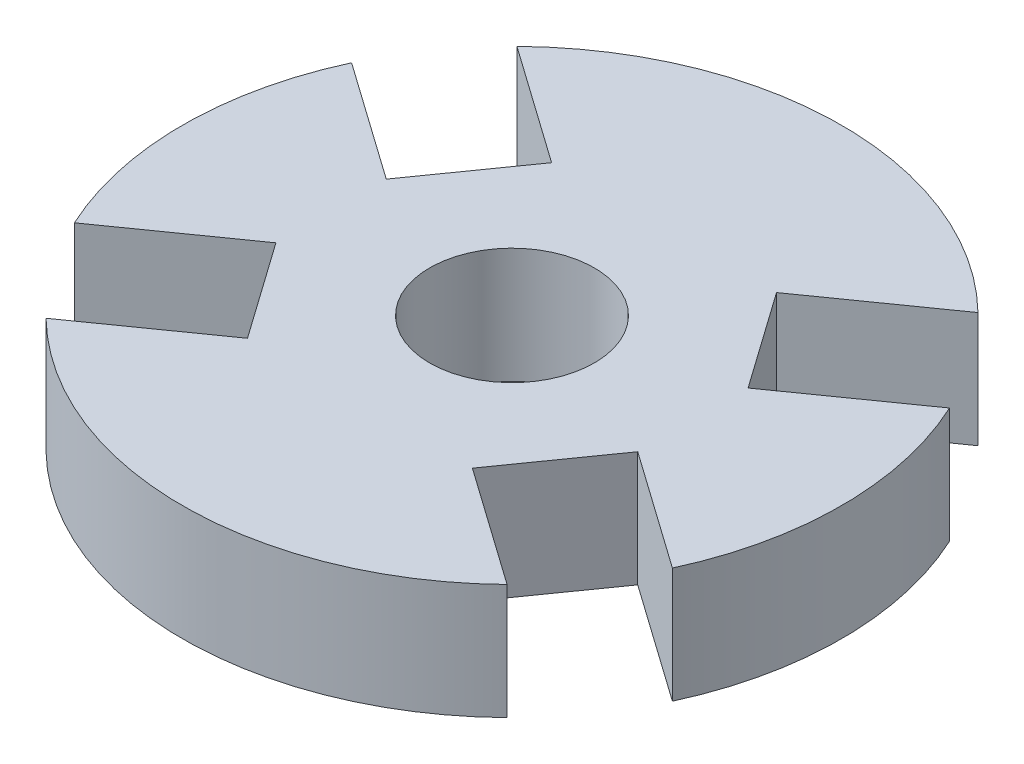
from build123d import *

# Parameters (mm, degrees)
CROQUIS1_R              = 10
CROQUIS1_R_2            = 2.5
SALIENTE_EXTRUIR1_DEPTH = 3.5
CORTAR_EXTRUIR1_DEPTH   = 3.5


with BuildPart() as part:
    # Croquis1 → Saliente-Extruir1 (new body)
    with BuildSketch(Plane(origin=(0, 0, 0), x_dir=(1, 0, 0), z_dir=(0, 1, 0))):
        with Locations(Location((0, 0, 0), (0, 0, 270))):
            Circle(CROQUIS1_R)
        with Locations(Location((0, 0, 0), (0, 0, 270))):
            Circle(CROQUIS1_R_2, mode=Mode.SUBTRACT)
    extrude(amount=SALIENTE_EXTRUIR1_DEPTH)

    # Croquis3 → Cortar-Extruir1 (cut)
    with BuildSketch(Plane(origin=(0, 3.5, 0), x_dir=(1, 0, 0), z_dir=(0, 1, 0))):
        Polygon((12.922578993, 6.924554295), (5.489940626, 1.674231742), (3.412889946, 4.614616151), (10.845528312, 9.864938704), align=None)
        Polygon((-3.412889946, -4.614616151), (-5.489940626, -1.674231742), (-12.922578993, -6.924554295), (-10.845528312, -9.864938704), align=None)
        Polygon((10.845528312, -9.864938704), (3.412889946, -4.614616151), (5.489940626, -1.674231742), (12.922578993, -6.924554295), align=None)
        Polygon((-5.489940626, 1.674231742), (-3.412889946, 4.614616151), (-10.845528312, 9.864938704), (-12.922578993, 6.924554295), align=None)
    extrude(amount=-CORTAR_EXTRUIR1_DEPTH, mode=Mode.SUBTRACT)


solid = part.part
